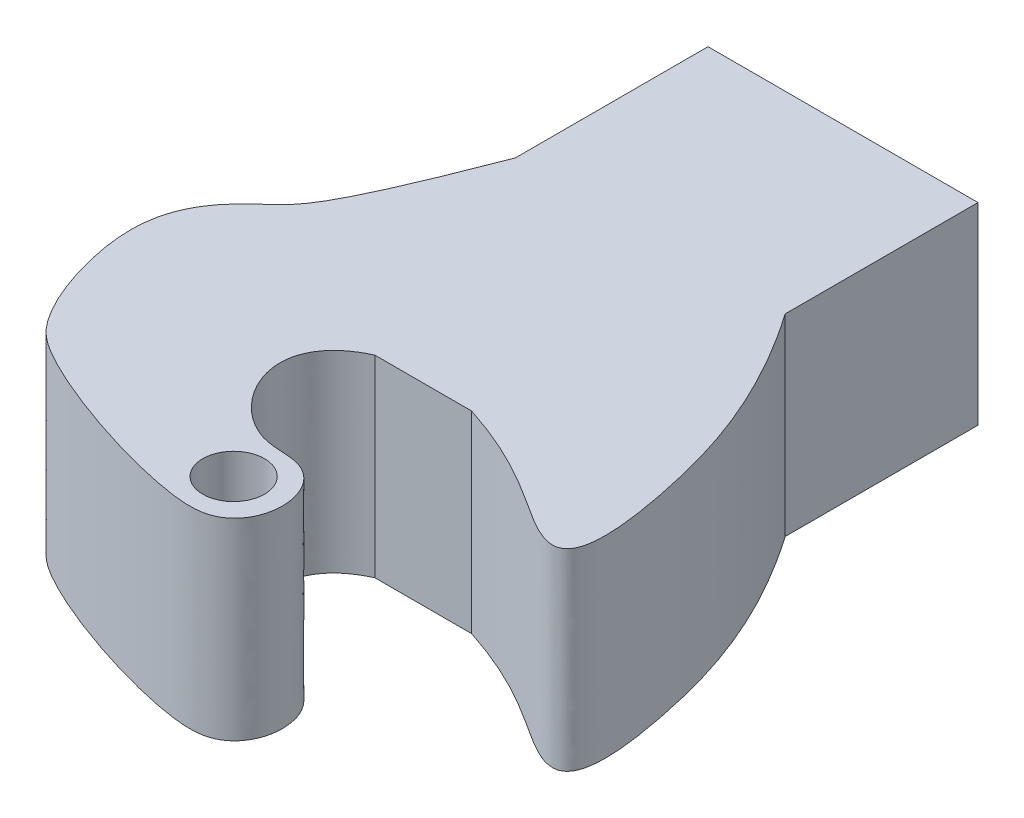
from build123d import *

# Parameters (mm, degrees)
SKETCH1_W           = 350
SKETCH1_H           = 250
BOSS_EXTRUDE1_DEPTH = 250
SKETCH2_R           = 40
BOSS_EXTRUDE2_DEPTH = 250


with BuildPart() as part:
    # Sketch1 → Boss-Extrude1 (new body)
    with BuildSketch(Plane.XY):
        Rectangle(SKETCH1_W, SKETCH1_H)
    extrude(amount=BOSS_EXTRUDE1_DEPTH)

    # Sketch2 → Boss-Extrude2 (add)
    with BuildSketch(Plane(origin=(0, 125, 0), x_dir=(1, 0, 0), z_dir=(0, 1, 0))):
        with BuildLine():
            Line((-44.761719829, -562.257161455), (80.895640954, -562.257161455))
            add(Edge.make_bspline(
                [(80.895640954, -562.257161455), (172.431287344, -592.316314524), (262.314302804, -669.613832446), (342.133537357, -676.640646609), (255.419582957, -365.16993701), (175, -250)],
                knots=[0, 0, 0, 0, 0.370060598, 0.815514955, 1, 1, 1, 1], degree=3))
            Line((175, -250), (-175, -250))
            add(Edge.make_bspline(
                [(-175, -250), (-243.158689552, -426.743473279), (-279.701762469, -458.647578572), (-372.289259306, -544.030243143), (-313.337421002, -725.664643324), (-239.02768417, -788.31097063), (-69.766922721, -847.84154556), (79.82482521, -857.588069073), (77.530765346, -724.034365353), (-68.959663963, -737.752024236), (-144.32805007, -608.054833161), (-44.761719829, -562.257161455)],
                knots=[0, 0, 0, 0, 0.137379521, 0.290337808, 0.419114902, 0.452202059, 0.602430788, 0.64183151, 0.80680856, 0.844687623, 1, 1, 1, 1], degree=3))
        make_face()
        with Locations(Location((0, -790, 0), (0, 0, 270))):
            Circle(SKETCH2_R, mode=Mode.SUBTRACT)
    extrude(amount=-BOSS_EXTRUDE2_DEPTH)


solid = part.part
